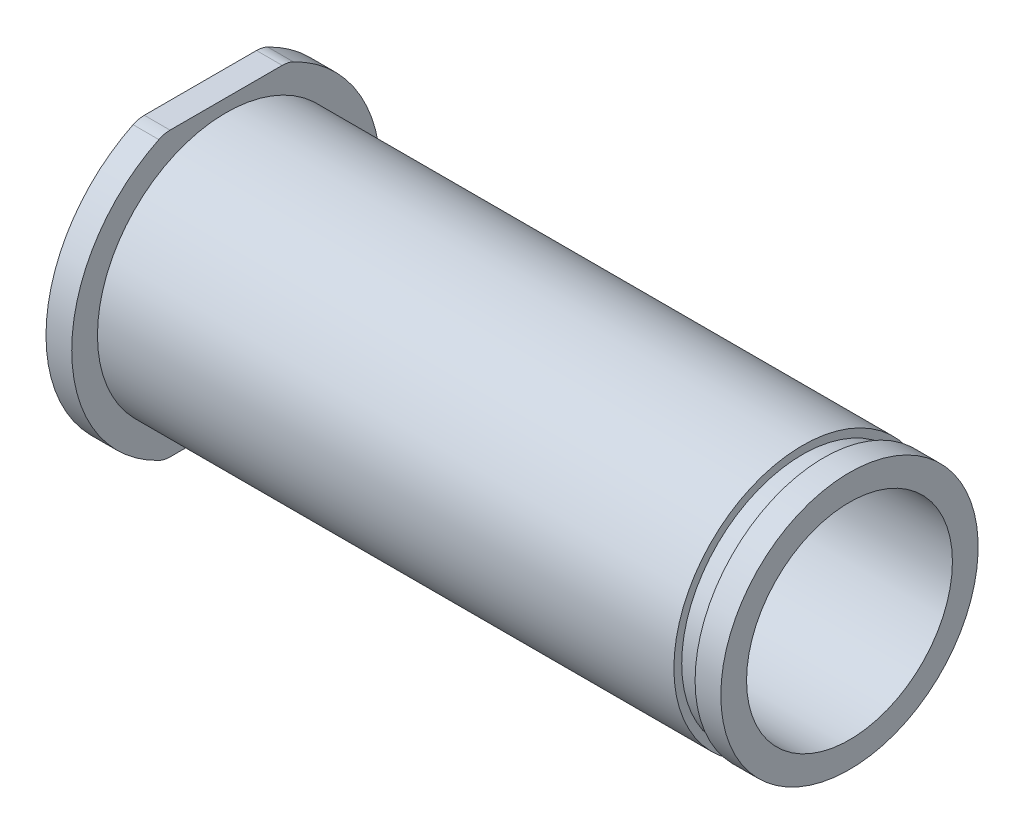
from build123d import *

# Parameters (mm, degrees)
SKETCH2_W          = 15.226765086
SKETCH2_H          = 1.5875
CUT_EXTRUDE1_DEPTH = 85.496179975
FILLET1_R          = 3.175


with BuildPart() as part:
    # Sketch1 → Revolve1 (revolve)
    with BuildSketch(Plane.XY, mode=Mode.PRIVATE) as revolve1_sk:
        Polygon((0, 19.05), (0, 12.7), (80.0862, 12.7), (80.0862, 15.875), (76.9112, 15.875), (76.9112, 14.9098), (74.295, 14.9098), (74.295, 15.875), (3.175, 15.875), (3.175, 19.05), align=None)
    revolve(revolve1_sk.sketch.rotate(Axis((0, 0, 0), (1, 0, 0)), 90), axis=Axis((0, 0, 0), (1, 0, 0)))

    # Sketch2 → Cut-Extrude1 (cut, through all)
    with BuildSketch(Plane.ZY):
        with Locations((0, 18.25625)):
            Rectangle(SKETCH2_W, SKETCH2_H)
        with Locations((0, -18.25625)):
            Rectangle(SKETCH2_W, SKETCH2_H)
    extrude(amount=-CUT_EXTRUDE1_DEPTH, mode=Mode.SUBTRACT)

    # Fillet1
    fillet1_edges = [part.edges().sort_by_distance(p)[0] for p in [
        (1.5875, 17.4625, 7.613382543),
        (1.5875, 17.4625, -7.613382543),
        (1.5875, -17.4625, -7.613382543),
        (1.5875, -17.4625, 7.613382543),
    ]]
    fillet(fillet1_edges, radius=FILLET1_R)


solid = part.part
